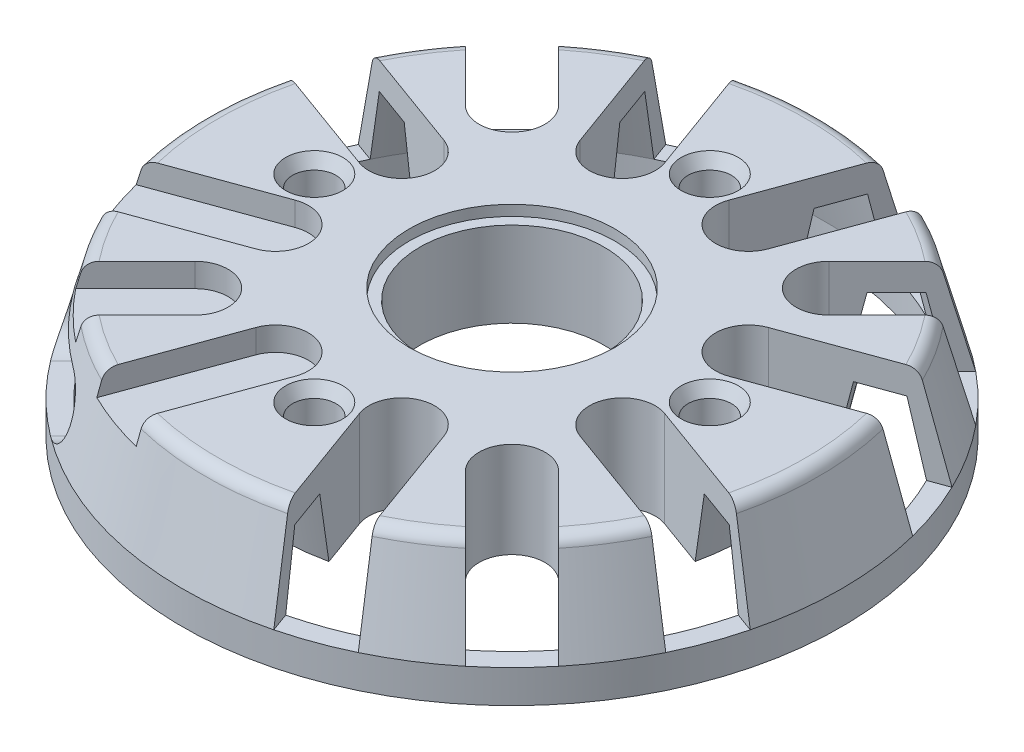
from build123d import *

# Parameters (mm, degrees)
SKETCH1_R                       = 25
BOSS_EXTRUDE1_DEPTH             = 7.25
BOSS_EXTRUDE1_TAPER             = 15
FILLET1_R                       = 1
SKETCH2_R                       = 7.8
CUT_EXTRUDE1_DEPTH              = 0.8
SKETCH3_R                       = 7
CUT_EXTRUDE2_DEPTH              = 36.93887187
M4X0_7_TAPPED_HOLE1_D           = 3.3
M4X0_7_TAPPED_HOLE1_CSINK_D     = 4.35
M4X0_7_TAPPED_HOLE1_CSINK_ANGLE = 60
CIRPATTERN2_COUNT               = 4
CUT_EXTRUDE4_DEPTH              = 37.0910309
CIRPATTERN1_COUNT               = 3
CIRPATTERN1_ANGLE               = 180
SKETCH8_R                       = 25
SKETCH8_R_2                     = 23.5
BOSS_EXTRUDE3_DEPTH             = 2.5
CUT_EXTRUDE5_DEPTH              = 1.8
SKETCH11_R                      = 23.5
SKETCH11_R_2                    = 18.052068071
CUT_EXTRUDE6_DEPTH              = 5.2
CUT_EXTRUDE6_DRAFT              = -12.5
CUT_EXTRUDE7_DEPTH              = 5


with BuildPart() as part:
    # Sketch1 → Boss-Extrude1 (new body)
    with BuildSketch(Plane(origin=(0, 0, 0), x_dir=(1, 0, 0), z_dir=(0, 1, 0))):
        Circle(SKETCH1_R)
    extrude(amount=BOSS_EXTRUDE1_DEPTH, taper=BOSS_EXTRUDE1_TAPER)

    # Fillet1
    fillet1_edges = [part.edges().sort_by_distance(p)[0] for p in [
        (-23.057368355, 7.25, 0),
    ]]
    fillet(fillet1_edges, radius=FILLET1_R)

    # Sketch2 → Cut-Extrude1 (cut)
    with BuildSketch(Plane(origin=(0, 7.25, 0), x_dir=(1, 0, 0), z_dir=(0, 1, 0))):
        with Locations(Location((0, 0, 0), (0, 0, 270))):
            Circle(SKETCH2_R)
    extrude(amount=-CUT_EXTRUDE1_DEPTH, mode=Mode.SUBTRACT)

    # Sketch3 → Cut-Extrude2 (cut, through all)
    with BuildSketch(Plane(origin=(0, 6.45, 0), x_dir=(1, 0, 0), z_dir=(0, 1, 0))):
        with Locations(Location((0, 0, 0), (0, 0, 270))):
            Circle(SKETCH3_R)
    extrude(amount=-CUT_EXTRUDE2_DEPTH, mode=Mode.SUBTRACT)

    # M4x0.7 Tapped Hole1 (through all)
    with Locations(Plane(origin=(0, 7.25, 0), x_dir=(1, 0, 0), z_dir=(0, 1, 0))):
        with Locations((0, 15)):
            m4x0_7_tapped_hole1 = CounterSinkHole(M4X0_7_TAPPED_HOLE1_D / 2, M4X0_7_TAPPED_HOLE1_CSINK_D / 2, counter_sink_angle=M4X0_7_TAPPED_HOLE1_CSINK_ANGLE)

    # CirPattern2: M4x0.7 Tapped Hole1 ×4 about axis
    cirpattern2_axis = Axis((0, 0, 0), (0, 1, 0))
    for i in range(1, CIRPATTERN2_COUNT):
        add(m4x0_7_tapped_hole1.rotate(cirpattern2_axis, i * 360 / CIRPATTERN2_COUNT), mode=Mode.SUBTRACT)

    # Sketch7 → Cut-Extrude4 (cut, through all)
    with BuildSketch(Plane(origin=(0, 7.25, 0), x_dir=(1, 0, 0), z_dir=(0, 1, 0))):
        with BuildLine():
            Line((-9.963493608, 34.683984707), (-2.439050455, 14.010747049))
            ThreePointArc((-2.439050455, 14.010747049), (-3.933231648, 10.806465139), (-7.137513559, 12.300646333))
            Line((-7.137513559, 12.300646333), (-14.661956712, 32.97388399))
            ThreePointArc((-14.661956712, 32.97388399), (-13.167775518, 36.1781659), (-9.963493608, 34.683984707))
        make_face()
        with BuildLine():
            Line((-32.97388399, 14.661956712), (-12.300646333, 7.137513559))
            ThreePointArc((-12.300646333, 7.137513559), (-10.806465139, 3.933231648), (-14.010747049, 2.439050455))
            Line((-14.010747049, 2.439050455), (-34.683984707, 9.963493608))
            ThreePointArc((-34.683984707, 9.963493608), (-36.1781659, 13.167775518), (-32.97388399, 14.661956712))
        make_face()
        with BuildLine():
            Line((-21.566756826, 25.102290732), (-10.253048327, 13.788582233))
            ThreePointArc((-10.253048327, 13.788582233), (-10.253048327, 10.253048327), (-13.788582233, 10.253048327))
            Line((-13.788582233, 10.253048327), (-25.102290732, 21.566756826))
            ThreePointArc((-25.102290732, 21.566756826), (-25.102290732, 25.102290732), (-21.566756826, 25.102290732))
        make_face()
    cut_extrude4 = extrude(amount=-CUT_EXTRUDE4_DEPTH, mode=Mode.SUBTRACT)

    # CirPattern1: Cut-Extrude4 ×3 about axis
    cirpattern1_axis = Axis((0, 0, 0), (0, -1, 0))
    for i in range(1, CIRPATTERN1_COUNT):
        add(cut_extrude4.rotate(cirpattern1_axis, i * CIRPATTERN1_ANGLE / (CIRPATTERN1_COUNT - 1)), mode=Mode.SUBTRACT)

    # Sketch8 → Boss-Extrude3 (add)
    with BuildSketch(Plane.XZ):
        with Locations(Location((0, 0, 0), (0, 0, 75.739170477))):
            Circle(SKETCH8_R)
        with Locations(Location((0, 0, 0), (0, 0, 76.10685173))):
            Circle(SKETCH8_R_2, mode=Mode.SUBTRACT)
    extrude(amount=BOSS_EXTRUDE3_DEPTH)

    # Sketch10 → Cut-Extrude5 (cut)
    with BuildSketch(Plane(origin=(0, 7.25, 0), x_dir=(1, 0, 0), z_dir=(0, 1, 0))):
        with BuildLine():
            Line((-34.683984707, -9.963493608), (-14.010747049, -2.439050455))
            ThreePointArc((-14.010747049, -2.439050455), (-10.806465139, -3.933231648), (-12.300646333, -7.137513559))
            Line((-12.300646333, -7.137513559), (-32.97388399, -14.661956712))
            ThreePointArc((-32.97388399, -14.661956712), (-36.1781659, -13.167775518), (-34.683984707, -9.963493608))
        make_face()
        with BuildLine():
            Line((-25.102290732, -21.566756826), (-13.788582233, -10.253048327))
            ThreePointArc((-13.788582233, -10.253048327), (-10.253048327, -10.253048327), (-10.253048327, -13.788582233))
            Line((-10.253048327, -13.788582233), (-21.566756826, -25.102290732))
            ThreePointArc((-21.566756826, -25.102290732), (-25.102290732, -25.102290732), (-25.102290732, -21.566756826))
        make_face()
        with BuildLine():
            Line((-14.661956712, -32.97388399), (-7.137513559, -12.300646333))
            ThreePointArc((-7.137513559, -12.300646333), (-3.933231648, -10.806465139), (-2.439050455, -14.010747049))
            Line((-2.439050455, -14.010747049), (-9.963493608, -34.683984707))
            ThreePointArc((-9.963493608, -34.683984707), (-13.167775518, -36.1781659), (-14.661956712, -32.97388399))
        make_face()
    extrude(amount=-CUT_EXTRUDE5_DEPTH, mode=Mode.SUBTRACT)


with BuildPart() as cut_extrude6_tool:
    # Sketch11 → Cut-Extrude6 (with draft: the straight prism first)
    with BuildSketch(Plane.XZ):
        with Locations(Location((0, 0, 0), (0, 0, 76.10685173))):
            Circle(SKETCH11_R)
        Circle(SKETCH11_R_2, mode=Mode.SUBTRACT)
    extrude(amount=-CUT_EXTRUDE6_DEPTH)
    # Cut-Extrude6: the draft: its side faces are tilted about the plane it starts from
    cut_extrude6_sides = [cut_extrude6_tool.faces().sort_by_distance(p)[0] for p in [
        (-5.642630999, 2.6, -22.812512256),
        (-18.052068071, 2.6, 0),
    ]]
    draft(cut_extrude6_sides, Plane.XZ, CUT_EXTRUDE6_DRAFT)


with BuildPart() as part_1:
    add(part.part)

    # Cut-Extrude6: cut by cut_extrude6_tool
    add(cut_extrude6_tool.part, mode=Mode.SUBTRACT)

    # Sketch12 → Cut-Extrude7 (cut)
    with BuildSketch(Plane(origin=(-17.67766953, 0, 17.67766953), x_dir=(0.7071067811865477, 0, 0.7071067811865475), z_dir=(-0.7071067811865475, 0, 0.7071067811865477))):
        with BuildLine():
            Line((-3.5, 4.5), (3.5, 4.5))
            ThreePointArc((3.5, 4.5), (5.75, 2.25), (3.5, 0))
            Line((3.5, 0), (-3.5, 0))
            ThreePointArc((-3.5, 0), (-5.75, 2.25), (-3.5, 4.5))
        make_face()
    extrude(amount=-CUT_EXTRUDE7_DEPTH, mode=Mode.SUBTRACT)


solid = part_1.part
